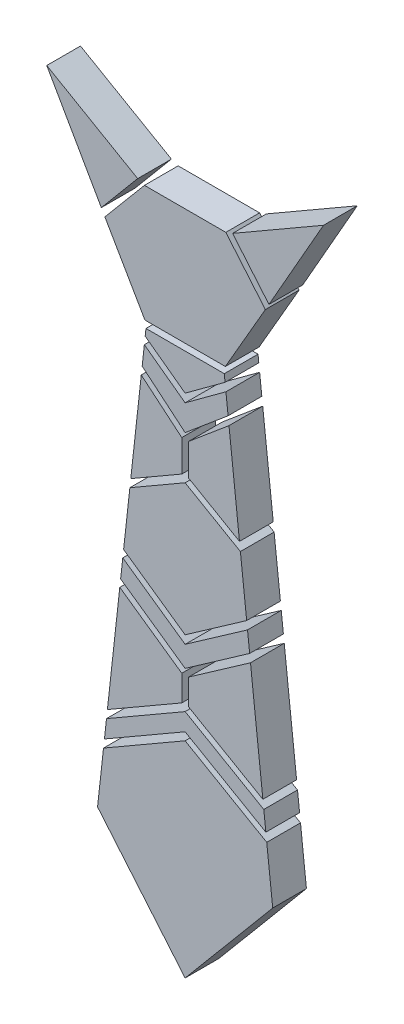
from build123d import *

# Parameters (mm, degrees)
BOSS_EXTRUDE1_DEPTH    = 12.7
BOSS_EXTRUDE1_2_DEPTH  = 12.7
BOSS_EXTRUDE1_3_DEPTH  = 12.7
BOSS_EXTRUDE1_4_DEPTH  = 12.7
BOSS_EXTRUDE1_5_DEPTH  = 12.7
BOSS_EXTRUDE1_6_DEPTH  = 12.7
BOSS_EXTRUDE1_7_DEPTH  = 12.7
BOSS_EXTRUDE1_8_DEPTH  = 12.7
BOSS_EXTRUDE1_9_DEPTH  = 12.7
BOSS_EXTRUDE1_10_DEPTH = 12.7
BOSS_EXTRUDE1_11_DEPTH = 12.7
BOSS_EXTRUDE1_12_DEPTH = 12.7
BOSS_EXTRUDE1_13_DEPTH = 12.7


with BuildPart() as part:
    # Offset_Pieces → Boss-Extrude1 (new body)
    with BuildSketch(Plane.XY):
        Polygon((-52.089952502, 146.418323379), (-31.549571397, 110.344916612), (-17.862182697, 126.656911268), align=None)
    extrude(amount=BOSS_EXTRUDE1_DEPTH)


with BuildPart() as body_2:
    # Offset_Pieces → Boss-Extrude1 2 (new body)
    with BuildSketch(Plane.XY):
        Polygon((15.033405216, 76.684377521), (14.737517247, 79.363979274), (-14.737517247, 79.363979274), (-15.033405216, 76.684377521), (0, 65.640755559), align=None)
    extrude(amount=BOSS_EXTRUDE1_2_DEPTH)


with BuildPart() as body_3:
    # Offset_Pieces → Boss-Extrude1 3 (new body)
    with BuildSketch(Plane.XY):
        Polygon((-15.141765158, 81.903979274), (15.141765158, 81.903979274), (30.20551595, 107.995160999), (15.324219086, 125.73), (-15.324219086, 125.73), (-30.20551595, 107.995160999), align=None)
    extrude(amount=BOSS_EXTRUDE1_3_DEPTH)


with BuildPart() as body_4:
    # Offset_Pieces → Boss-Extrude1 4 (new body)
    with BuildSketch(Plane.XY):
        Polygon((31.549571397, 110.344916612), (52.089952502, 146.418323379), (17.862182697, 126.656911268), align=None)
    extrude(amount=BOSS_EXTRUDE1_4_DEPTH)


with BuildPart() as body_5:
    # Offset_Pieces → Boss-Extrude1 5 (new body)
    with BuildSketch(Plane.XY):
        Polygon((15.355310757, 73.769157091), (0, 62.489061552), (-15.355310757, 73.769157091), (-16.174863317, 66.347177466), (0, 52.774855623), (16.174863317, 66.347177466), align=None)
    extrude(amount=BOSS_EXTRUDE1_5_DEPTH)


with BuildPart() as body_6:
    # Offset_Pieces → Boss-Extrude1 6 (new body)
    with BuildSketch(Plane.XY):
        Polygon((20.459364211, 27.546153708), (16.509947246, 63.312611753), (1.27, 50.52477764), (1.27, 38.625138301), align=None)
    extrude(amount=BOSS_EXTRUDE1_6_DEPTH)


with BuildPart() as body_7:
    # Offset_Pieces → Boss-Extrude1 7 (new body)
    with BuildSketch(Plane.XY):
        Polygon((-1.27, 50.52477764), (-16.509947246, 63.312611753), (-20.459364211, 27.546153708), (-1.27, 38.625138301), align=None)
    extrude(amount=BOSS_EXTRUDE1_7_DEPTH)


with BuildPart() as body_8:
    # Offset_Pieces → Boss-Extrude1 8 (new body)
    with BuildSketch(Plane.XY):
        Polygon((0, -13.138928754), (23.161122376, 3.078663726), (20.805279226, 24.413500214), (0, 36.425433775), (-20.805279226, 24.413500214), (-23.161122376, 3.078663726), align=None)
    extrude(amount=BOSS_EXTRUDE1_8_DEPTH)


with BuildPart() as body_9:
    # Offset_Pieces → Boss-Extrude1 9 (new body)
    with BuildSketch(Plane.XY):
        Polygon((24.283013627, -7.081336274), (23.478943019, 0.200436681), (0, -16.23969621), (-23.478943019, 0.200436681), (-24.283013627, -7.081336274), (0, -24.084485466), align=None)
    extrude(amount=BOSS_EXTRUDE1_9_DEPTH)


with BuildPart() as body_10:
    # Offset_Pieces → Boss-Extrude1 10 (new body)
    with BuildSketch(Plane.XY):
        Polygon((-24.60083427, -9.959563319), (-29.258182314, -52.137141647), (-1.27, -35.978157054), (-1.27, -26.295989347), align=None)
    extrude(amount=BOSS_EXTRUDE1_10_DEPTH)


with BuildPart() as body_11:
    # Offset_Pieces → Boss-Extrude1 11 (new body)
    with BuildSketch(Plane.XY):
        Polygon((1.27, -26.295989347), (1.27, -35.978157054), (29.258182314, -52.137141647), (24.60083427, -9.959563319), align=None)
    extrude(amount=BOSS_EXTRUDE1_11_DEPTH)


with BuildPart() as body_12:
    # Offset_Pieces → Boss-Extrude1 12 (new body)
    with BuildSketch(Plane.XY):
        Polygon((30.380073565, -62.297141647), (29.604097328, -55.269795142), (0, -38.17786158), (-29.604097328, -55.269795142), (-30.380073565, -62.297141647), (0, -44.757197997), align=None)
    extrude(amount=BOSS_EXTRUDE1_12_DEPTH)


with BuildPart() as body_13:
    # Offset_Pieces → Boss-Extrude1 13 (new body)
    with BuildSketch(Plane.XY):
        Polygon((-30.72598858, -65.429795142), (-32.968072436, -85.734411973), (0, -125.02423074), (32.968072436, -85.734411973), (30.72598858, -65.429795142), (0, -47.690137364), align=None)
    extrude(amount=BOSS_EXTRUDE1_13_DEPTH)


solid = Compound([part.part, body_2.part, body_3.part, body_4.part, body_5.part, body_6.part, body_7.part, body_8.part, body_9.part, body_10.part, body_11.part, body_12.part, body_13.part])
